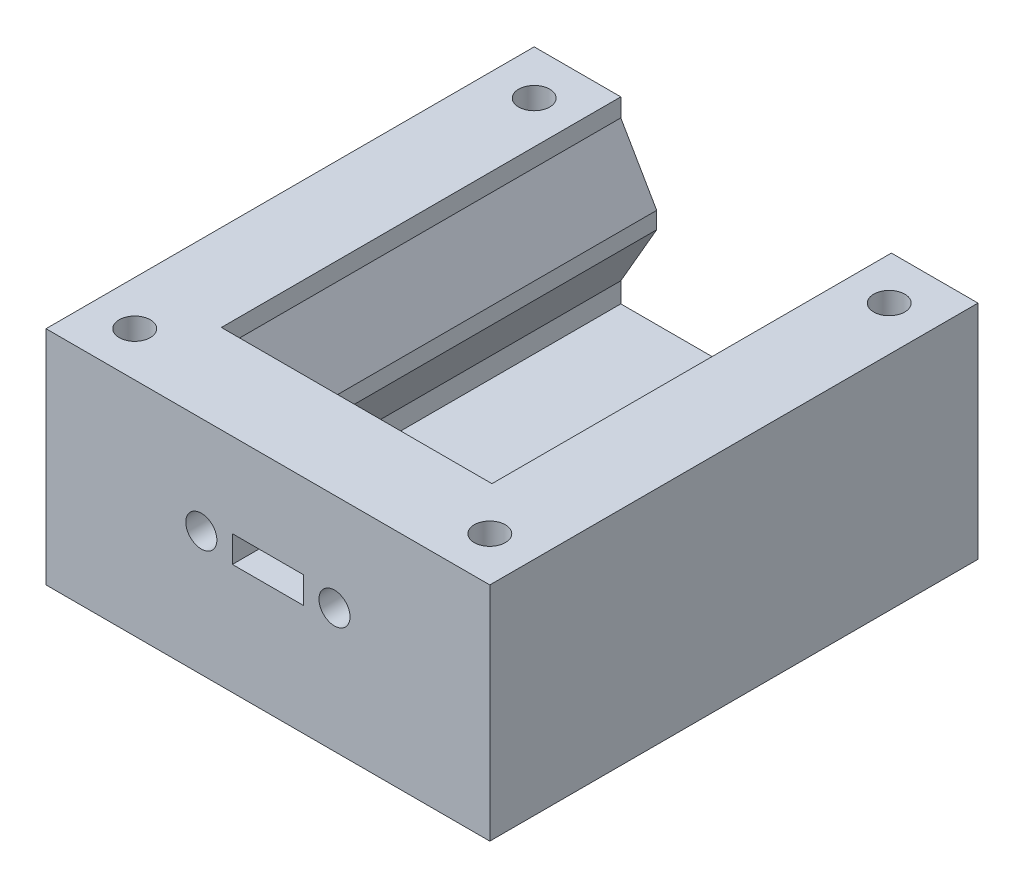
from build123d import *

# Parameters (mm, degrees)
SCHIZZO1_W                   = 50
SCHIZZO1_H                   = 25
SCHIZZO1_R                   = 1.75
SCHIZZO1_W_2                 = 8
SCHIZZO1_H_2                 = 3
ESTRUSIONE_ESTRUSIONE1_DEPTH = 10
ESTRUSIONE_ESTRUSIONE2_DEPTH = 45
TAGLIO_ESTRUSIONE1_DEPTH     = 3
SCHIZZO4_R                   = 1.75
TAGLIO_ESTRUSIONE2_DEPTH     = 58.227615711


with BuildPart() as part:
    # Schizzo1 → Estrusione-Estrusione1 (new body)
    with BuildSketch(Plane.XY):
        Rectangle(SCHIZZO1_W, SCHIZZO1_H)
        with Locations((-7.5, 1.5)):
            Circle(SCHIZZO1_R, mode=Mode.SUBTRACT)
        with Locations((7.5, 1.5)):
            Circle(SCHIZZO1_R, mode=Mode.SUBTRACT)
        with Locations((0, 1.5)):
            Rectangle(SCHIZZO1_W_2, SCHIZZO1_H_2, mode=Mode.SUBTRACT)
    extrude(amount=ESTRUSIONE_ESTRUSIONE1_DEPTH)

    # Schizzo2 → Estrusione-Estrusione2 (add)
    with BuildSketch(Plane(origin=(0, 0, 0), x_dir=(-1, 0, 0), z_dir=(0, 0, -1))):
        Polygon((-15.241451884, 12.5), (-25, 12.5), (-25, -12.5), (25, -12.5), (25, 12.5), (15.241451884, 12.5), (15.241451884, 10.446410162), (11.2, 3.446410162), (11.2, 1.553589838), (15.241451884, -5.446410162), (15.241451884, -7.7), (0, -7.7), (-15.241451884, -7.7), (-15.241451884, -5.446410162), (-11.2, 1.553589838), (-11.2, 3.446410162), (-15.241451884, 10.446410162), align=None)
    extrude(amount=ESTRUSIONE_ESTRUSIONE2_DEPTH)

    # Schizzo3 → Taglio-Estrusione1 (cut)
    with BuildSketch(Plane(origin=(0, 0, 0), x_dir=(-1, 0, 0), z_dir=(0, 0, -1))):
        Polygon((-7.5, 4.75), (-10.314582562, 3.125), (-10.314582562, -0.125), (-7.5, -1.75), (-4.685417438, -0.125), (-4.685417438, 3.125), align=None)
        Polygon((7.5, 4.75), (4.685417438, 3.125), (4.685417438, -0.125), (7.5, -1.75), (10.314582562, -0.125), (10.314582562, 3.125), align=None)
    extrude(amount=-TAGLIO_ESTRUSIONE1_DEPTH, mode=Mode.SUBTRACT)

    # Schizzo4 → Taglio-Estrusione2 (cut, through all)
    with BuildSketch(Plane(origin=(0, 12.5, 0), x_dir=(1, 0, 0), z_dir=(0, 1, 0))):
        with Locations(Location((-20, -5, 0), (0, 0, 180))):
            Circle(SCHIZZO4_R)
        with Locations(Location((-20, 40, 0), (0, 0, 180))):
            Circle(SCHIZZO4_R)
        with Locations(Location((20, 40, 0), (0, 0, 180))):
            Circle(SCHIZZO4_R)
        with Locations(Location((20, -5, 0), (0, 0, 180))):
            Circle(SCHIZZO4_R)
    extrude(amount=-TAGLIO_ESTRUSIONE2_DEPTH, mode=Mode.SUBTRACT)


solid = part.part
